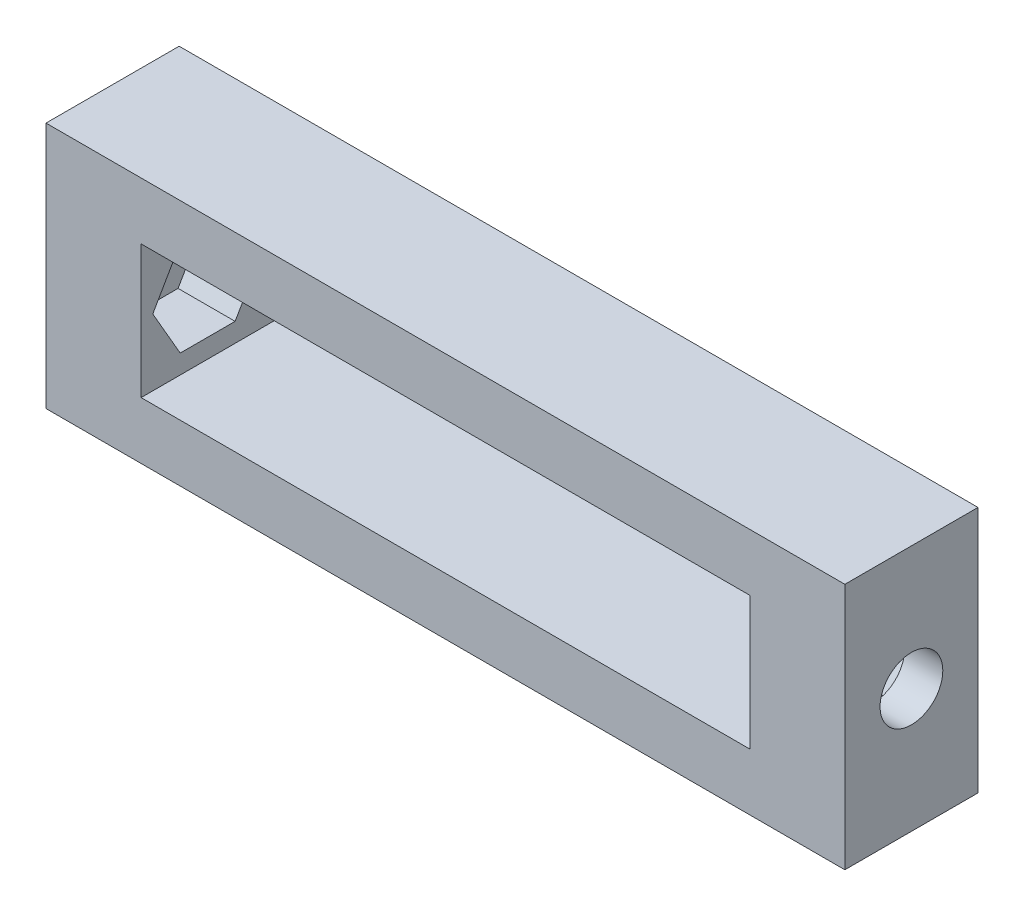
from build123d import *

# Parameters (mm, degrees)
SKETCH1_W           = 42
SKETCH1_H           = 7
BOSS_EXTRUDE1_DEPTH = 3
SKETCH3_W           = 5
SKETCH3_H           = 7
BOSS_EXTRUDE2_DEPTH = 7
CUT_EXTRUDE1_DEPTH  = 3
CUT_EXTRUDE2_REACH  = 42.758
SKETCH5_R           = 1.65


with BuildPart() as part:
    # Sketch1 → Boss-Extrude1 (new body)
    with BuildSketch(Plane(origin=(0, 0, 0), x_dir=(1, 0, 0), z_dir=(0, 1, 0))):
        Rectangle(SKETCH1_W, SKETCH1_H)
    boss_extrude1 = extrude(amount=-BOSS_EXTRUDE1_DEPTH)

    # Sketch3 → Boss-Extrude2 (add)
    with BuildSketch(Plane(origin=(0, 0, 0), x_dir=(1, 0, 0), z_dir=(0, 1, 0))):
        with Locations((-18.5, 0)):
            Rectangle(SKETCH3_W, SKETCH3_H)
    boss_extrude2 = extrude(amount=BOSS_EXTRUDE2_DEPTH)

    # Sketch4 → Cut-Extrude1 (cut)
    with BuildSketch(Plane(origin=(-16, 0, 0), x_dir=(0, 0, -1), z_dir=(1, 0, 0))):
        Polygon((1.443375673, 6), (-1.443375673, 6), (-2.886751346, 3.5), (-1.443375673, 1), (1.443375673, 1), (2.886751346, 3.5), align=None)
    cut_extrude1 = extrude(amount=-CUT_EXTRUDE1_DEPTH, mode=Mode.SUBTRACT)

    # Sketch5 → Cut-Extrude2 (cut, up to next)
    with BuildSketch(Plane(origin=(-19, 0, 0), x_dir=(0, 0, -1), z_dir=(1, 0, 0)), mode=Mode.PRIVATE) as cut_extrude2_sk1:
        with Locations((0, 3.5)):
            Circle(SKETCH5_R)
    cut_extrude2_tool1 = extrude(cut_extrude2_sk1.sketch, amount=-CUT_EXTRUDE2_REACH, mode=Mode.PRIVATE) & part.part
    cut_extrude2 = cut_extrude2_tool1.solids().sort_by_distance((-19, 3.5, 0))[0]
    add(cut_extrude2, mode=Mode.SUBTRACT)

    # Mirror3: Boss-Extrude1 across plane
    add(boss_extrude1.mirror(Plane.ZX.offset(3.5)))

    # Mirror4: Boss-Extrude2, Cut-Extrude1, Cut-Extrude2 across plane
    add(boss_extrude2.mirror(Plane(origin=(0, 0, 0), x_dir=(0, 0, 1), z_dir=(1, 0, 0))))
    add(cut_extrude1.mirror(Plane(origin=(0, 0, 0), x_dir=(0, 0, 1), z_dir=(1, 0, 0))), mode=Mode.SUBTRACT)
    add(cut_extrude2.mirror(Plane(origin=(0, 0, 0), x_dir=(0, 0, 1), z_dir=(1, 0, 0))), mode=Mode.SUBTRACT)


solid = part.part
